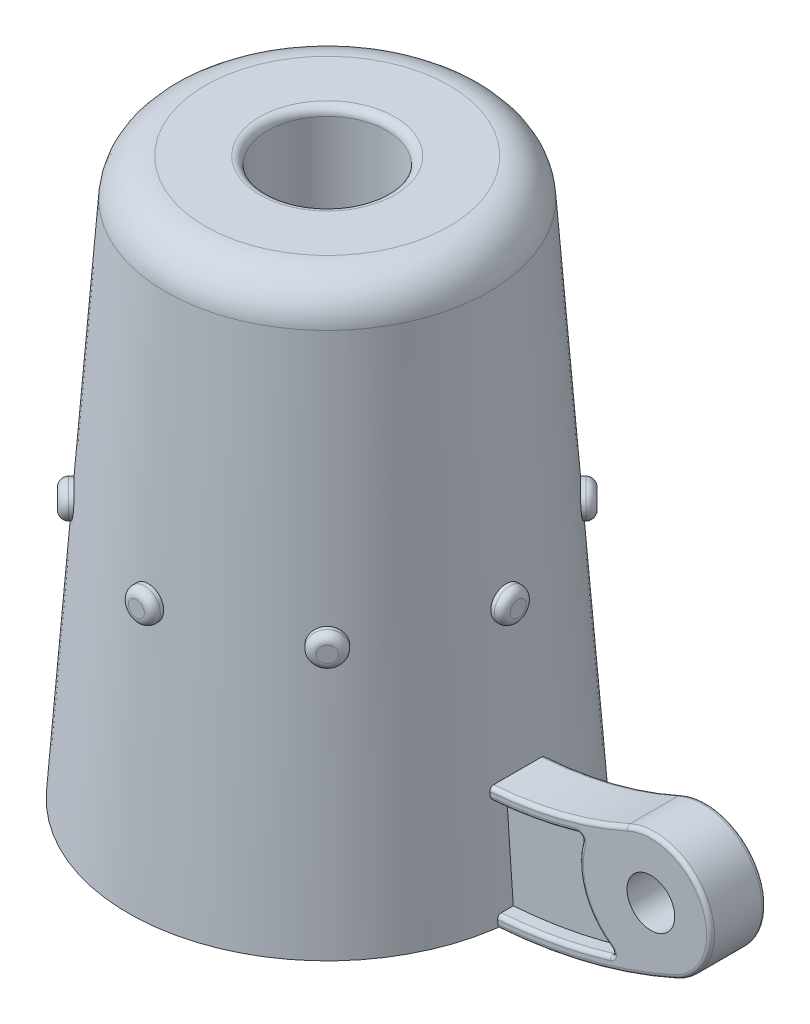
from build123d import *

# Parameters (mm, degrees)
FILLET1_R                = 5
BOSS_EXTRUDE1_DEPTH      = 3.5
BOSS_EXTRUDE1_DEPTH_BACK = 3.5
SKETCH3_R                = 3
CUT_EXTRUDE1_DEPTH       = 14.5
CUT_EXTRUDE2_DEPTH       = 2
SKETCH5_R                = 7.5
CUT_EXTRUDE3_DEPTH       = 40
SKETCH6_R                = 18
CUT_EXTRUDE4_DEPTH       = 40
FILLET2_R                = 0.5
FILLET3_R                = 1
BOSS_EXTRUDE2_REACH      = 101.867
SKETCH7_R                = 2
CIRPATTERN1_COUNT        = 8
FILLET5_R                = 1


with BuildPart() as part:
    # Sketch1 → Revolve1 (revolve)
    with BuildSketch(Plane.XY):
        Polygon((0, 0), (-25, 0), (-20, 70), (0, 70), align=None)
    revolve(axis=Axis((0, 0, 0), (0, 1, 0)))

    # Fillet1
    fillet1_edges = [part.edges().sort_by_distance(p)[0] for p in [
        (20, 70, 0),
    ]]
    fillet(fillet1_edges, radius=FILLET1_R)

    # Sketch5 → Cut-Extrude3 (cut)
    with BuildSketch(Plane(origin=(0, 70, 0), x_dir=(1, 0, 0), z_dir=(0, 1, 0))):
        Circle(SKETCH5_R)
    extrude(amount=-CUT_EXTRUDE3_DEPTH, mode=Mode.SUBTRACT)

    # Sketch6 → Cut-Extrude4 (cut)
    with BuildSketch(Plane.XZ):
        Circle(SKETCH6_R)
    extrude(amount=-CUT_EXTRUDE4_DEPTH, mode=Mode.SUBTRACT)

    # Fillet3
    fillet3_edges = [part.edges().sort_by_distance(p)[0] for p in [
        (-7.5, 70, 0),
    ]]
    fillet(fillet3_edges, radius=FILLET3_R)

    # Boss-Extrude2: up to this cone (the profile starts outside it)
    boss_extrude2_end = Plane(origin=(0, 32.678118, 0), z_dir=(0, -1, 0)) * Cone(13.734930949, 31.59676648, 250.065697429, mode=Mode.PRIVATE)
    # Sketch7 → Boss-Extrude2 (add, up to the surface)
    with BuildSketch(Plane.XY.offset(-24), mode=Mode.PRIVATE) as boss_extrude2_sk1:
        with Locations((0, 32.678117625)):
            Circle(SKETCH7_R)
    boss_extrude2_tool1 = extrude(boss_extrude2_sk1.sketch, amount=BOSS_EXTRUDE2_REACH, mode=Mode.PRIVATE) - boss_extrude2_end
    boss_extrude2 = boss_extrude2_tool1.solids().sort_by_distance((0, 32.678118, -24))[0]
    add(boss_extrude2)

    # CirPattern1: Boss-Extrude2 ×8 about axis
    cirpattern1_axis = Axis((0, 70, 0), (0, 1, 0))
    for i in range(1, CIRPATTERN1_COUNT):
        add(boss_extrude2.rotate(cirpattern1_axis, i * 360 / CIRPATTERN1_COUNT))

    # Fillet5
    fillet5_edges = [part.edges().sort_by_distance(p)[0] for p in [
        (24, 32.678117625, -2),
        (-18.384776311, 32.678117625, -15.556349186),
        (-2, 32.678117625, -24),
        (-15.556349186, 32.678117625, 18.384776311),
        (2, 32.678117625, 24),
        (18.384776311, 32.678117625, 15.556349186),
        (15.556349186, 32.678117625, -18.384776311),
        (-24, 32.678117625, 2),
    ]]
    fillet(fillet5_edges, radius=FILLET5_R)


with BuildPart() as body_2:
    # Sketch2 → Boss-Extrude1 (new, two sides: drawn at the far end of the back side and taken through both)
    with BuildSketch(Plane.XY.offset(-BOSS_EXTRUDE1_DEPTH_BACK)):
        with BuildLine():
            Line((23.929673507, 14.984570908), (24.998379256, 0.022690411))
            ThreePointArc((24.998379256, 0.022690411), (36.3886949, 1.854874368), (47.280875201, 5.657057531))
            ThreePointArc((47.280875201, 5.657057531), (51.030875201, 15.578624948), (41.109307784, 19.328624948))
            ThreePointArc((41.109307784, 19.328624948), (32.711519919, 16.397170753), (23.929673507, 14.984570908))
        make_face()
    extrude(amount=BOSS_EXTRUDE1_DEPTH + BOSS_EXTRUDE1_DEPTH_BACK)

    # Sketch3 → Cut-Extrude1 (cut)
    with BuildSketch(Plane(origin=(0, 0, -3.5), x_dir=(-1, 0, 0), z_dir=(0, 0, -1))):
        with Locations((-44.195091493, 12.49284124)):
            Circle(SKETCH3_R)
    extrude(amount=-CUT_EXTRUDE1_DEPTH, mode=Mode.SUBTRACT)

    # Sketch4 → Cut-Extrude2 (cut)
    with BuildSketch(Plane(origin=(0, 0, -3.5), x_dir=(-1, 0, 0), z_dir=(0, 0, -1))):
        with BuildLine():
            Line((-24.036544082, 13.488382859), (-24.891508681, 1.518878461))
            ThreePointArc((-24.891508681, 1.518878461), (-32.029257184, 2.434322556), (-39.019114115, 4.145284763))
            ThreePointArc((-39.019114115, 4.145284763), (-39.367566478, 4.549189407), (-39.153222506, 5.037671415))
            ThreePointArc((-39.153222506, 5.037671415), (-35.762955147, 9.346561428), (-35.501993696, 14.823088159))
            ThreePointArc((-35.501993696, 14.823088159), (-35.368750613, 15.309904906), (-34.87916433, 15.432581454))
            ThreePointArc((-34.87916433, 15.432581454), (-29.509481179, 14.172563181), (-24.036544082, 13.488382859))
        make_face()
    cut_extrude2 = extrude(amount=-CUT_EXTRUDE2_DEPTH, mode=Mode.SUBTRACT)

    # Mirror1: Cut-Extrude2 across plane
    add(cut_extrude2.mirror(Plane.XY), mode=Mode.SUBTRACT)

    # Fillet2
    fillet2_edges = [body_2.edges().sort_by_distance(p)[0] for p in [
        (32.029257184, 2.434322556, 3.5),
        (39.367566478, 4.549189407, 3.5),
        (35.762955147, 9.346561428, 3.5),
        (35.368750613, 15.309904906, 3.5),
        (32.029257184, 2.434322556, -3.5),
        (39.367566478, 4.549189407, -3.5),
        (35.762955147, 9.346561428, -3.5),
        (35.368750613, 15.309904906, -3.5),
        (29.509481179, 14.172563181, 3.5),
        (29.509481179, 14.172563181, -3.5),
        (36.3886949, 1.854874368, -3.5),
        (32.711519919, 16.397170753, -3.5),
        (36.3886949, 1.854874368, 3.5),
        (32.711519919, 16.397170753, 3.5),
        (51.030875201, 15.578624948, -3.5),
        (51.030875201, 15.578624948, 3.5),
    ]]
    fillet(fillet2_edges, radius=FILLET2_R)


solid = Compound([part.part, body_2.part])
